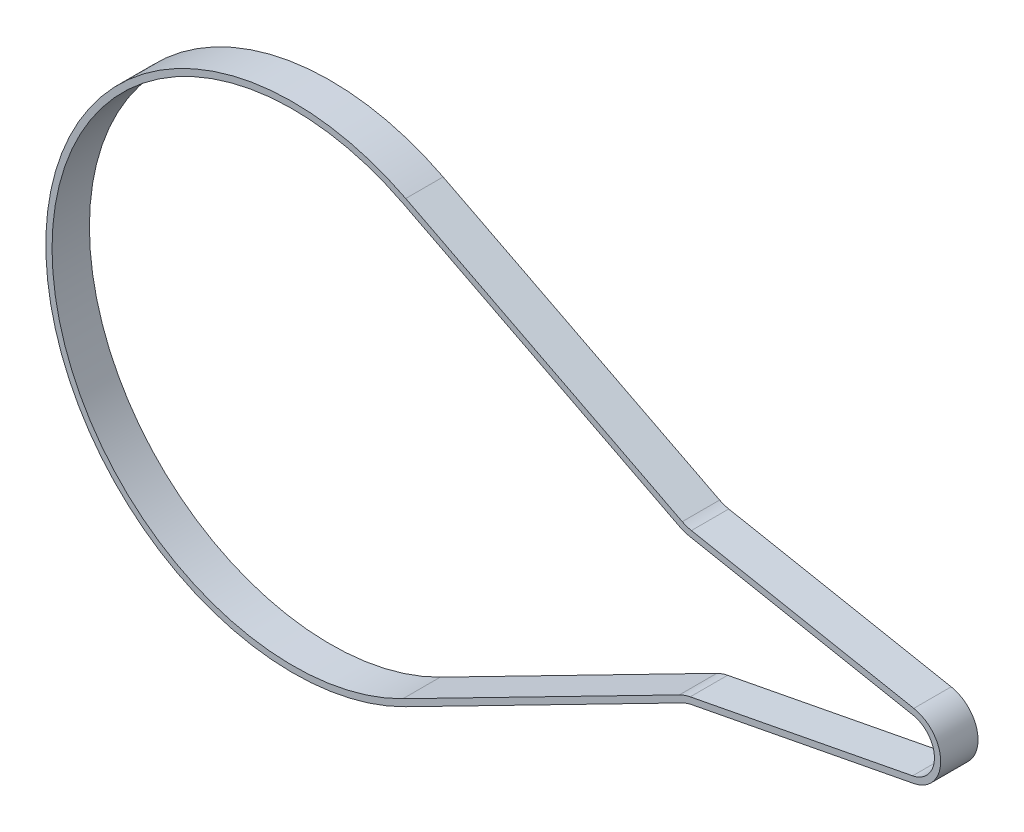
from build123d import *

# Parameters (mm, degrees)
EXTRUDE_THIN1_DEPTH = 3


with BuildPart() as part:
    # Sketch2 → Extrude-Thin1 (new, symmetric)
    with BuildSketch(Plane.XY):
        with BuildLine():
            Line((-46.905429915, 52.838302672), (-2.506709708, 30.104450343))
            ThreePointArc((-2.506709708, 30.104450343), (-1.790955408, 29.799761666), (-1.039373746, 29.599101721))
            Line((-1.039373746, 29.599101721), (34.672228001, 22.726596561))
            ThreePointArc((34.672228001, 22.726596561), (38.98889768, 17.5), (34.672228001, 12.273403439))
            Line((34.672228001, 12.273403439), (-1.039373746, 5.400898279))
            ThreePointArc((-1.039373746, 5.400898279), (-1.790955408, 5.200238334), (-2.506709708, 4.895549657))
            Line((-2.506709708, 4.895549657), (-46.905429915, -17.838302672))
            ThreePointArc((-46.905429915, -17.838302672), (-104.7015, 17.5), (-46.905429915, 52.838302672))
        make_face()
        with BuildLine():
            Line((-47.361195317, 51.948202734), (-2.962475109, 29.214350406))
            ThreePointArc((-2.962475109, 29.214350406), (-2.116583664, 28.854263787), (-1.228350791, 28.617120216))
            Line((-1.228350791, 28.617120216), (34.483250956, 21.744615056))
            ThreePointArc((34.483250956, 21.744615056), (37.98889768, 17.5), (34.483250956, 13.255384944))
            Line((34.483250956, 13.255384944), (-1.228350791, 6.382879784))
            ThreePointArc((-1.228350791, 6.382879784), (-2.116583664, 6.145736213), (-2.962475109, 5.785649594))
            Line((-2.962475109, 5.785649594), (-47.361195317, -16.948202734))
            ThreePointArc((-47.361195317, -16.948202734), (-103.7015, 17.5), (-47.361195317, 51.948202734))
        make_face(mode=Mode.SUBTRACT)
    extrude(amount=EXTRUDE_THIN1_DEPTH, both=True)


solid = part.part
